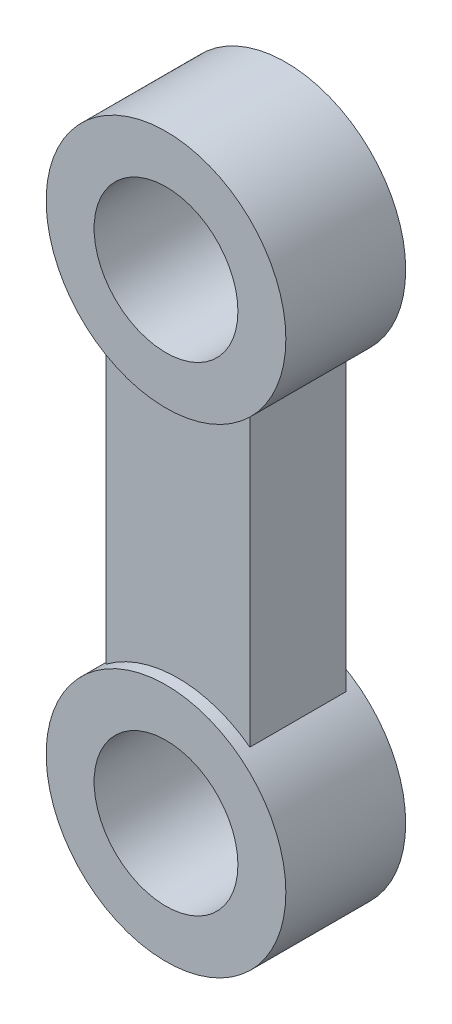
from build123d import *

# Parameters (mm, degrees)
SKETCH1_R               = 25
SKETCH1_R_2             = 15
BOSS_EXTRUDE1_DEPTH     = 12.5
SKETCH2_W               = 30
SKETCH2_H               = 20
BOSS_EXTRUDE2_DEPTH     = 100
SKETCH3_R               = 25
SKETCH3_R_2             = 15
BOSS_EXTRUDE3_DEPTH     = 12.5
CUT_EXTRUDE1_DEPTH      = 129.086884574
CUT_EXTRUDE1_DEPTH_BACK = 129.086884574
SKETCH4_R               = 15


with BuildPart() as part:
    # Sketch1 → Boss-Extrude1 (new, symmetric)
    with BuildSketch(Plane.XY):
        Circle(SKETCH1_R)
        Circle(SKETCH1_R_2, mode=Mode.SUBTRACT)
    extrude(amount=BOSS_EXTRUDE1_DEPTH, both=True)

    # Sketch2 → Boss-Extrude2 (add)
    with BuildSketch(Plane(origin=(0, 0, 0), x_dir=(1, 0, 0), z_dir=(0, 1, 0))):
        Rectangle(SKETCH2_W, SKETCH2_H)
    extrude(amount=-BOSS_EXTRUDE2_DEPTH)

    # Sketch3 → Boss-Extrude3 (add, symmetric)
    with BuildSketch(Plane.XY):
        with Locations((0, -100)):
            Circle(SKETCH3_R)
        with Locations((0, -100)):
            Circle(SKETCH3_R_2, mode=Mode.SUBTRACT)
    extrude(amount=BOSS_EXTRUDE3_DEPTH, both=True)

    # Sketch4 → Cut-Extrude1 (cut, two sides: drawn at the far end of the back side and taken through both)
    with BuildSketch(Plane.XY.offset(-CUT_EXTRUDE1_DEPTH_BACK)):
        Circle(SKETCH4_R)
        with Locations((0, -100)):
            Circle(SKETCH4_R)
    extrude(amount=CUT_EXTRUDE1_DEPTH + CUT_EXTRUDE1_DEPTH_BACK, mode=Mode.SUBTRACT)


solid = part.part
